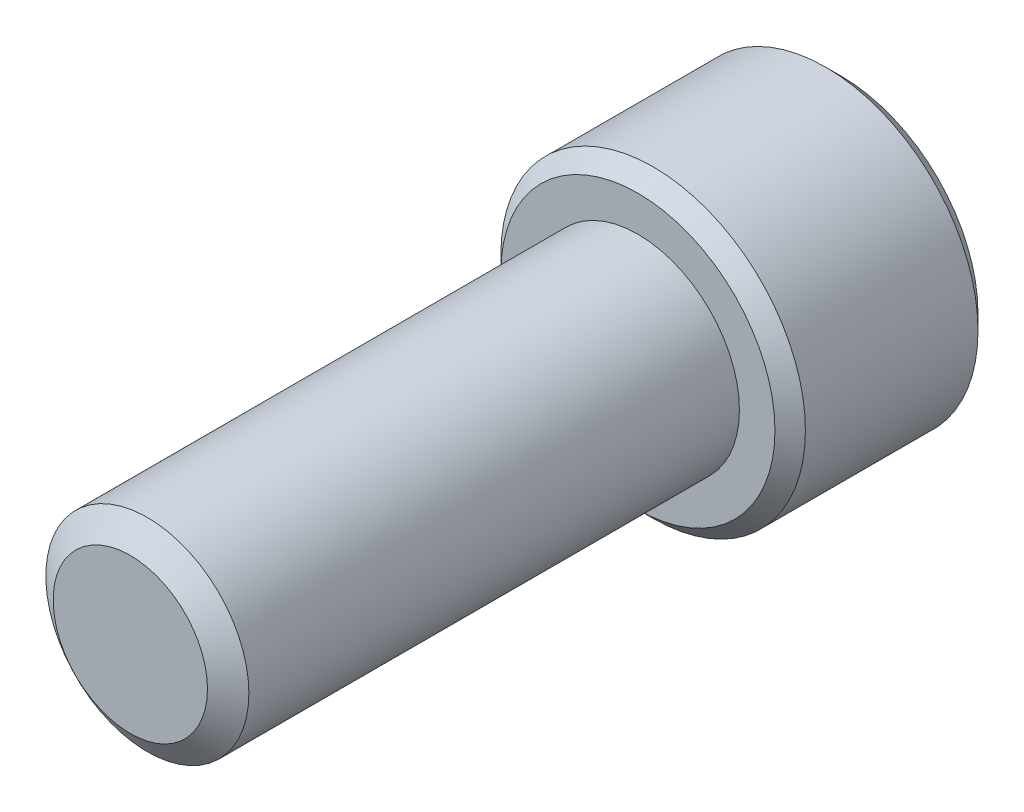
from build123d import *

# Parameters (mm, degrees)
SKETCH1_R          = 6.35
EXTRUDE1_DEPTH     = 31.75
SKETCH6_R          = 9.525
EXTRUDE2_DEPTH     = 12.7
CUT_EXTRUDE1_DEPTH = 7.14375
CHAMFER1_SIZE      = 0.9525


with BuildPart() as part:
    # Sketch1 → Extrude1 (new body)
    with BuildSketch(Plane.XY):
        Circle(SKETCH1_R)
    extrude(amount=-EXTRUDE1_DEPTH)

    # Sketch4 → Cut-Revolve1 (revolve, cut)
    with BuildSketch(Plane(origin=(0, 0, 0), x_dir=(0, 0, -1), z_dir=(1, 0, 0)), mode=Mode.PRIVATE) as cut_revolve1_sk:
        Polygon((1.066458305, 6.35), (0, 4.826939697), (0, 6.35), align=None)
    revolve(cut_revolve1_sk.sketch.rotate(Axis((0, 0, 0), (0, 0, -1)), 90), axis=Axis((0, 0, 0), (0, 0, -1)), mode=Mode.SUBTRACT)

    # Sketch6 → Extrude2 (add)
    with BuildSketch(Plane(origin=(0, 0, -31.75), x_dir=(-1, 0, 0), z_dir=(0, 0, -1))):
        Circle(SKETCH6_R)
    extrude(amount=EXTRUDE2_DEPTH)

    # Sketch7 → Cut-Extrude1 (cut)
    with BuildSketch(Plane(origin=(0, 0, -44.45), x_dir=(-1, 0, 0), z_dir=(0, 0, -1))):
        Polygon((0, 5.499261314), (-4.7625, 2.749630657), (-4.7625, -2.749630657), (0, -5.499261314), (4.7625, -2.749630657), (4.7625, 2.749630657), align=None)
    extrude(amount=-CUT_EXTRUDE1_DEPTH, mode=Mode.SUBTRACT)

    # Cut-Extrude2 cone 1 section (through the dimple's axis) → Cut-Extrude2 (revolve, cut)
    with BuildSketch(Plane(origin=(0, 0, -44.45), x_dir=(0, 1, 0), z_dir=(1, 0, 0))):
        Polygon((0, 0), (5.499261314, 0), (0, 5.499261314), align=None)
    revolve(axis=Axis((0, 0, -44.45), (0, 0, 1)), mode=Mode.SUBTRACT)

    # Chamfer1
    chamfer1_edges = [part.edges().sort_by_distance(p)[0] for p in [
        (9.525, 0, -31.75),
        (9.525, 0, -44.45),
    ]]
    chamfer(chamfer1_edges, length=CHAMFER1_SIZE)


solid = part.part
